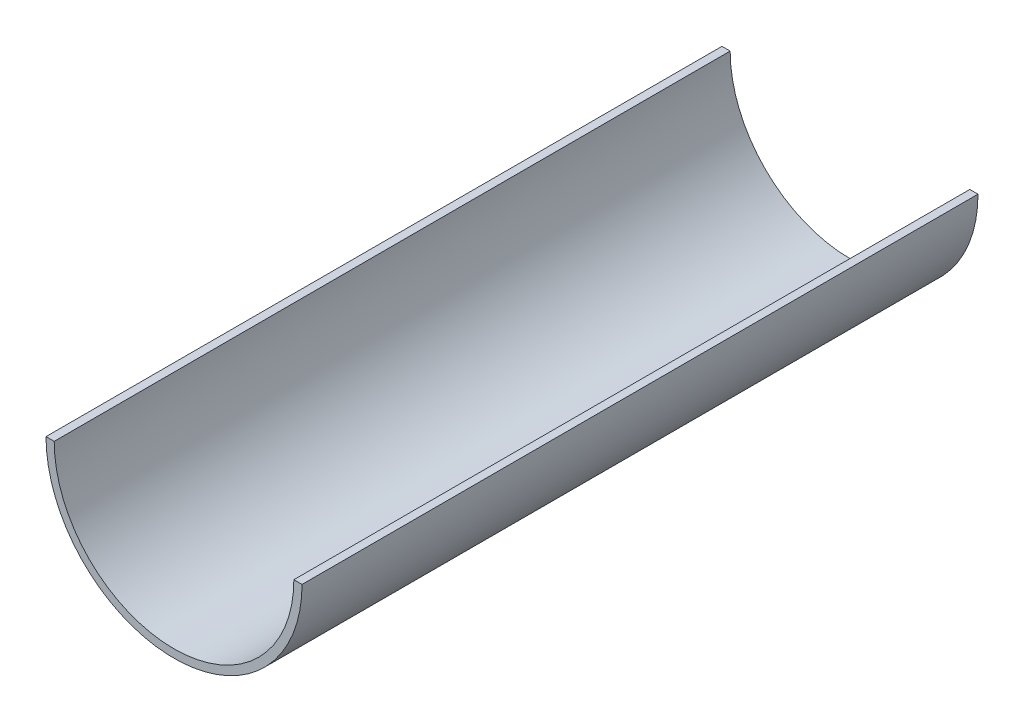
from build123d import *

# Parameters (mm, degrees)
BOSS_EXTRUDE1_DEPTH = 330


with BuildPart() as part:
    # Sketch1 → Boss-Extrude1 (new body)
    with BuildSketch(Plane.XY):
        with BuildLine():
            Line((-62.5, 0), (-58.5, 0))
            ThreePointArc((-58.5, 0), (0, -58.5), (58.5, 0))
            Line((58.5, 0), (62.5, 0))
            ThreePointArc((62.5, 0), (0, -62.5), (-62.5, 0))
        make_face()
    extrude(amount=BOSS_EXTRUDE1_DEPTH)


solid = part.part
